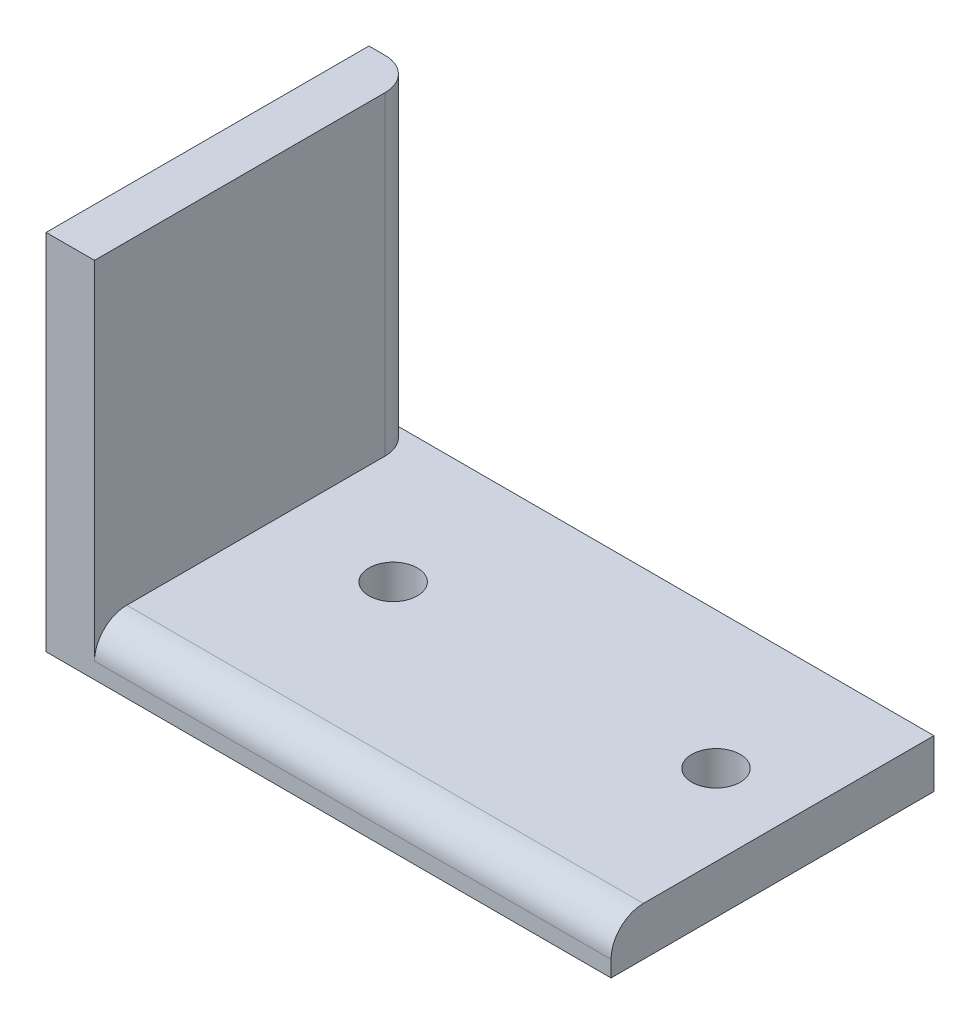
from build123d import *

# Parameters (mm, degrees)
EXTRUDE_1_DEPTH      = 40
FILLET_1_R           = 8
SKETCH_9_R           = 6
CUT_EXTRUDE_7_DEPTH  = 172.172427686
SKETCH_10_R          = 6
CUT_EXTRUDE_14_DEPTH = 172.172427686


with BuildPart() as part:
    # 草图8 → 凸台-拉伸1 (new, symmetric)
    with BuildSketch(Plane.XY):
        Polygon((0, 0), (140, 0), (140, 12), (12, 12), (12, 90), (0, 90), align=None)
    extrude(amount=EXTRUDE_1_DEPTH, both=True)

    # 圆角1
    fillet_1_edges = [part.edges().sort_by_distance(p)[0] for p in [
        (76, 12, 40),
        (12, 51, -40),
    ]]
    fillet(fillet_1_edges, radius=FILLET_1_R)

    # 草图9 → 切除-拉伸7 (cut, through all)
    with BuildSketch(Plane(origin=(0, 0, 0), x_dir=(1, 0, 0), z_dir=(0, 1, 0))):
        with Locations(Location((40, 6, 0), (0, 0, 90))):
            Circle(SKETCH_9_R)
    extrude(amount=CUT_EXTRUDE_7_DEPTH, mode=Mode.SUBTRACT)

    # 草图10 → 切除-拉伸14 (cut, through all)
    with BuildSketch(Plane(origin=(0, 0, 0), x_dir=(1, 0, 0), z_dir=(0, 1, 0))):
        with Locations(Location((120, 6, 0), (0, 0, 90))):
            Circle(SKETCH_10_R)
    extrude(amount=CUT_EXTRUDE_14_DEPTH, mode=Mode.SUBTRACT)


solid = part.part
